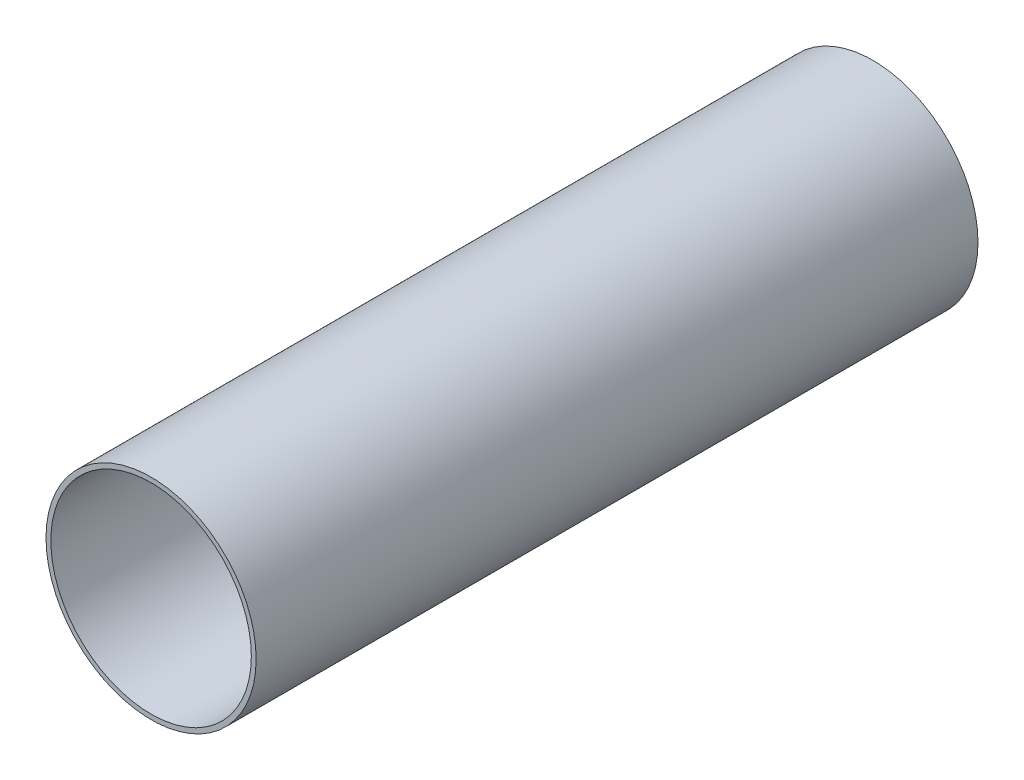
from build123d import *

# Parameters (mm, degrees)
SKETCH1_R           = 33.274
SKETCH1_R_2         = 31.75
BOSS_EXTRUDE1_DEPTH = 228.6


with BuildPart() as part:
    # Sketch1 → Boss-Extrude1 (new body)
    with BuildSketch(Plane.XY):
        Circle(SKETCH1_R)
        Circle(SKETCH1_R_2, mode=Mode.SUBTRACT)
    extrude(amount=BOSS_EXTRUDE1_DEPTH)


solid = part.part
